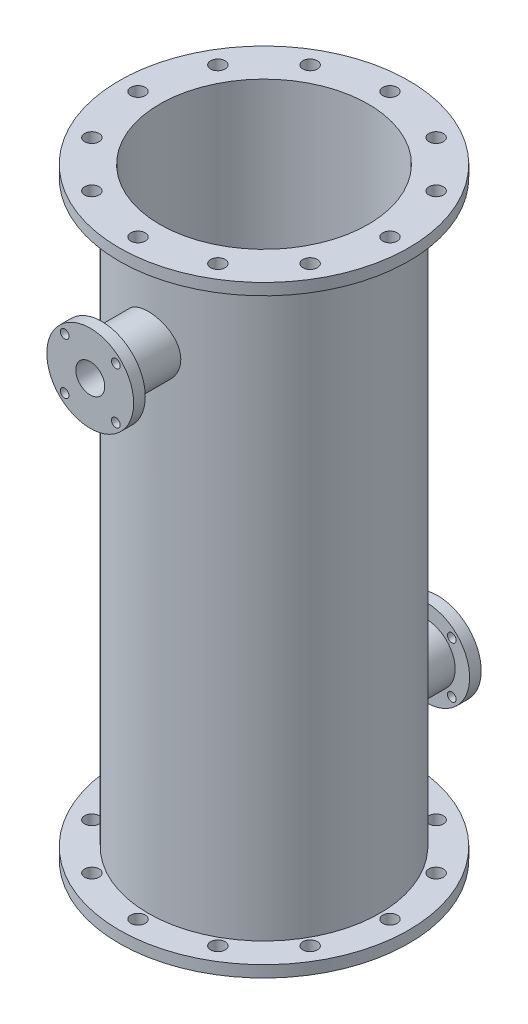
from build123d import *

# Parameters (mm, degrees)
SKETCH1_R                = 250
SKETCH1_R_2              = 12.5
BOSS_EXTRUDE1_DEPTH      = 20
SKETCH2_R                = 200
BOSS_EXTRUDE2_DEPTH      = 1000
SKETCH3_R                = 250
SKETCH3_R_2              = 12.5
BOSS_EXTRUDE3_DEPTH      = 20
SKETCH4_R                = 180
CUT_EXTRUDE1_DEPTH       = 1040
BOSS_EXTRUDE5_DEPTH      = 80
BOSS_EXTRUDE5_DEPTH_BACK = 10
SKETCH6_R                = 50
SKETCH7_R                = 75
SKETCH7_R_2              = 7.5
BOSS_EXTRUDE6_DEPTH      = 20
SKETCH8_R                = 25
CUT_EXTRUDE2_DEPTH       = 142
BOSS_EXTRUDE7_DEPTH      = 80
BOSS_EXTRUDE7_DEPTH_BACK = 13
SKETCH9_R                = 50
SKETCH10_R               = 75
SKETCH10_R_2             = 7.5
BOSS_EXTRUDE8_DEPTH      = 20
SKETCH11_R               = 25
CUT_EXTRUDE3_DEPTH       = 145


with BuildPart() as part:
    # Sketch1 → Boss-Extrude1 (new body)
    with BuildSketch(Plane(origin=(0, 0, 0), x_dir=(1, 0, 0), z_dir=(0, 1, 0))):
        with Locations(Location((0, 0, 0), (0, 0, 270))):
            Circle(SKETCH1_R)
        with Locations(Location((0, 217.5, 0), (0, 0, 270))):
            Circle(SKETCH1_R_2, mode=Mode.SUBTRACT)
        with Locations(Location((108.75, 188.360525323, 0), (0, 0, 270))):
            Circle(SKETCH1_R_2, mode=Mode.SUBTRACT)
        with Locations(Location((188.360525323, 108.75, 0), (0, 0, 270))):
            Circle(SKETCH1_R_2, mode=Mode.SUBTRACT)
        with Locations(Location((217.5, 0, 0), (0, 0, 270))):
            Circle(SKETCH1_R_2, mode=Mode.SUBTRACT)
        with Locations(Location((188.360525323, -108.75, 0), (0, 0, 270))):
            Circle(SKETCH1_R_2, mode=Mode.SUBTRACT)
        with Locations(Location((108.75, -188.360525323, 0), (0, 0, 270))):
            Circle(SKETCH1_R_2, mode=Mode.SUBTRACT)
        with Locations(Location((0, -217.5, 0), (0, 0, 270))):
            Circle(SKETCH1_R_2, mode=Mode.SUBTRACT)
        with Locations(Location((-108.75, -188.360525323, 0), (0, 0, 270))):
            Circle(SKETCH1_R_2, mode=Mode.SUBTRACT)
        with Locations(Location((-188.360525323, -108.75, 0), (0, 0, 270))):
            Circle(SKETCH1_R_2, mode=Mode.SUBTRACT)
        with Locations(Location((-217.5, 0, 0), (0, 0, 270))):
            Circle(SKETCH1_R_2, mode=Mode.SUBTRACT)
        with Locations(Location((-188.360525323, 108.75, 0), (0, 0, 270))):
            Circle(SKETCH1_R_2, mode=Mode.SUBTRACT)
        with Locations(Location((-108.75, 188.360525323, 0), (0, 0, 270))):
            Circle(SKETCH1_R_2, mode=Mode.SUBTRACT)
    extrude(amount=BOSS_EXTRUDE1_DEPTH)

    # Sketch2 → Boss-Extrude2 (add)
    with BuildSketch(Plane(origin=(0, 20, 0), x_dir=(1, 0, 0), z_dir=(0, 1, 0))):
        with Locations(Location((0, 0, 0), (0, 0, 270))):
            Circle(SKETCH2_R)
    extrude(amount=BOSS_EXTRUDE2_DEPTH)

    # Sketch3 → Boss-Extrude3 (add)
    with BuildSketch(Plane(origin=(0, 1020, 0), x_dir=(1, 0, 0), z_dir=(0, 1, 0))):
        with Locations(Location((0, 0, 0), (0, 0, 270))):
            Circle(SKETCH3_R)
        with Locations(Location((0, 217.5, 0), (0, 0, 270))):
            Circle(SKETCH3_R_2, mode=Mode.SUBTRACT)
        with Locations(Location((108.75, 188.360525323, 0), (0, 0, 270))):
            Circle(SKETCH3_R_2, mode=Mode.SUBTRACT)
        with Locations(Location((188.360525323, 108.75, 0), (0, 0, 270))):
            Circle(SKETCH3_R_2, mode=Mode.SUBTRACT)
        with Locations(Location((217.5, 0, 0), (0, 0, 270))):
            Circle(SKETCH3_R_2, mode=Mode.SUBTRACT)
        with Locations(Location((188.360525323, -108.75, 0), (0, 0, 270))):
            Circle(SKETCH3_R_2, mode=Mode.SUBTRACT)
        with Locations(Location((108.75, -188.360525323, 0), (0, 0, 270))):
            Circle(SKETCH3_R_2, mode=Mode.SUBTRACT)
        with Locations(Location((0, -217.5, 0), (0, 0, 270))):
            Circle(SKETCH3_R_2, mode=Mode.SUBTRACT)
        with Locations(Location((-108.75, -188.360525323, 0), (0, 0, 270))):
            Circle(SKETCH3_R_2, mode=Mode.SUBTRACT)
        with Locations(Location((-188.360525323, -108.75, 0), (0, 0, 270))):
            Circle(SKETCH3_R_2, mode=Mode.SUBTRACT)
        with Locations(Location((-217.5, 0, 0), (0, 0, 270))):
            Circle(SKETCH3_R_2, mode=Mode.SUBTRACT)
        with Locations(Location((-188.360525323, 108.75, 0), (0, 0, 270))):
            Circle(SKETCH3_R_2, mode=Mode.SUBTRACT)
        with Locations(Location((-108.75, 188.360525323, 0), (0, 0, 270))):
            Circle(SKETCH3_R_2, mode=Mode.SUBTRACT)
    extrude(amount=BOSS_EXTRUDE3_DEPTH)

    # Sketch4 → Cut-Extrude1 (cut)
    with BuildSketch(Plane(origin=(0, 1040, 0), x_dir=(1, 0, 0), z_dir=(0, 1, 0))):
        with Locations(Location((0, 0, 0), (0, 0, 270))):
            Circle(SKETCH4_R)
    extrude(amount=-CUT_EXTRUDE1_DEPTH, mode=Mode.SUBTRACT)

    # Sketch6 → Boss-Extrude5 (add, two sides: drawn at the far end of the back side and taken through both)
    with BuildSketch(Plane(origin=(0, 0, -200), x_dir=(-1, 0, 0), z_dir=(0, 0, -1)).offset(-BOSS_EXTRUDE5_DEPTH_BACK)):
        with Locations((0, 170)):
            Circle(SKETCH6_R)
    extrude(amount=BOSS_EXTRUDE5_DEPTH + BOSS_EXTRUDE5_DEPTH_BACK)

    # Sketch7 → Boss-Extrude6 (add)
    with BuildSketch(Plane(origin=(0, 0, -280), x_dir=(-1, 0, 0), z_dir=(0, 0, -1))):
        with Locations((0, 170)):
            Circle(SKETCH7_R)
        with Locations((44.194173824, 214.194173824)):
            Circle(SKETCH7_R_2, mode=Mode.SUBTRACT)
        with Locations((44.194173824, 125.805826176)):
            Circle(SKETCH7_R_2, mode=Mode.SUBTRACT)
        with Locations((-44.194173824, 125.805826176)):
            Circle(SKETCH7_R_2, mode=Mode.SUBTRACT)
        with Locations((-44.194173824, 214.194173824)):
            Circle(SKETCH7_R_2, mode=Mode.SUBTRACT)
    extrude(amount=BOSS_EXTRUDE6_DEPTH)

    # Sketch8 → Cut-Extrude2 (cut)
    with BuildSketch(Plane(origin=(0, 0, -300), x_dir=(-1, 0, 0), z_dir=(0, 0, -1))):
        with Locations((0, 170)):
            Circle(SKETCH8_R)
    extrude(amount=-CUT_EXTRUDE2_DEPTH, mode=Mode.SUBTRACT)

    # Sketch9 → Boss-Extrude7 (add, two sides: drawn at the far end of the back side and taken through both)
    with BuildSketch(Plane.XY.offset(200).offset(-BOSS_EXTRUDE7_DEPTH_BACK)):
        with Locations((0, 870)):
            Circle(SKETCH9_R)
    extrude(amount=BOSS_EXTRUDE7_DEPTH + BOSS_EXTRUDE7_DEPTH_BACK)

    # Sketch10 → Boss-Extrude8 (add)
    with BuildSketch(Plane.XY.offset(280)):
        with Locations((0, 870)):
            Circle(SKETCH10_R)
        with Locations((44.194173824, 914.194173824)):
            Circle(SKETCH10_R_2, mode=Mode.SUBTRACT)
        with Locations((44.194173824, 825.805826176)):
            Circle(SKETCH10_R_2, mode=Mode.SUBTRACT)
        with Locations((-44.194173824, 825.805826176)):
            Circle(SKETCH10_R_2, mode=Mode.SUBTRACT)
        with Locations((-44.194173824, 914.194173824)):
            Circle(SKETCH10_R_2, mode=Mode.SUBTRACT)
    extrude(amount=BOSS_EXTRUDE8_DEPTH)

    # Sketch11 → Cut-Extrude3 (cut)
    with BuildSketch(Plane.XY.offset(300)):
        with Locations((0, 870)):
            Circle(SKETCH11_R)
    extrude(amount=-CUT_EXTRUDE3_DEPTH, mode=Mode.SUBTRACT)


solid = part.part
